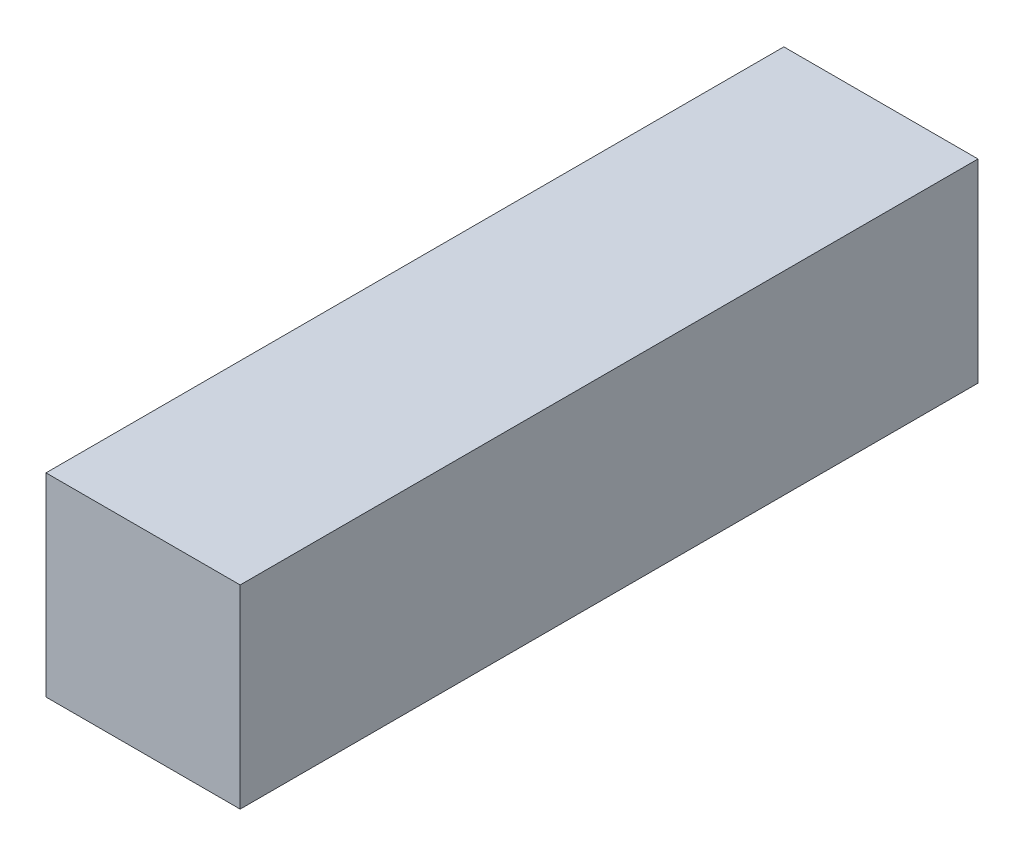
from build123d import *

# Parameters (mm, degrees)
SKETCH1_W      = 31.75
SKETCH1_H      = 31.75
EXTRUDE1_DEPTH = 120.65


with BuildPart() as part:
    # Sketch1 → Extrude1 (new body)
    with BuildSketch(Plane.XY):
        with Locations((15.875, 15.875)):
            Rectangle(SKETCH1_W, SKETCH1_H)
    extrude(amount=EXTRUDE1_DEPTH)


solid = part.part
